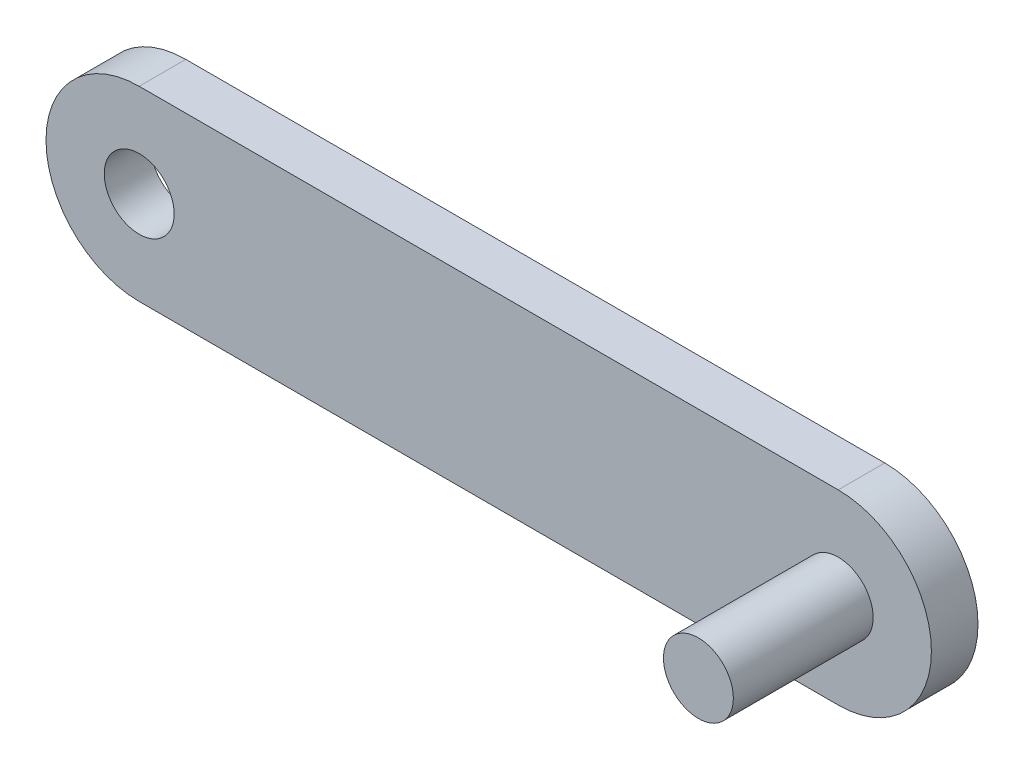
from build123d import *

# Parameters (mm, degrees)
SKETCH1_R           = 1.5
BOSS_EXTRUDE1_DEPTH = 2
SKETCH2_R           = 1.5
BOSS_EXTRUDE2_DEPTH = 6


with BuildPart() as part:
    # Sketch1 → Boss-Extrude1 (new body)
    with BuildSketch(Plane.XY):
        with BuildLine():
            Line((0, 4), (30, 4))
            ThreePointArc((30, 4), (34, 0), (30, -4))
            Line((30, -4), (0, -4))
            ThreePointArc((0, -4), (-4, 0), (0, 4))
        make_face()
        Circle(SKETCH1_R, mode=Mode.SUBTRACT)
    extrude(amount=BOSS_EXTRUDE1_DEPTH)

    # Sketch2 → Boss-Extrude2 (add)
    with BuildSketch(Plane.XY.offset(2)):
        with Locations((30, 0)):
            Circle(SKETCH2_R)
    extrude(amount=BOSS_EXTRUDE2_DEPTH)


solid = part.part
